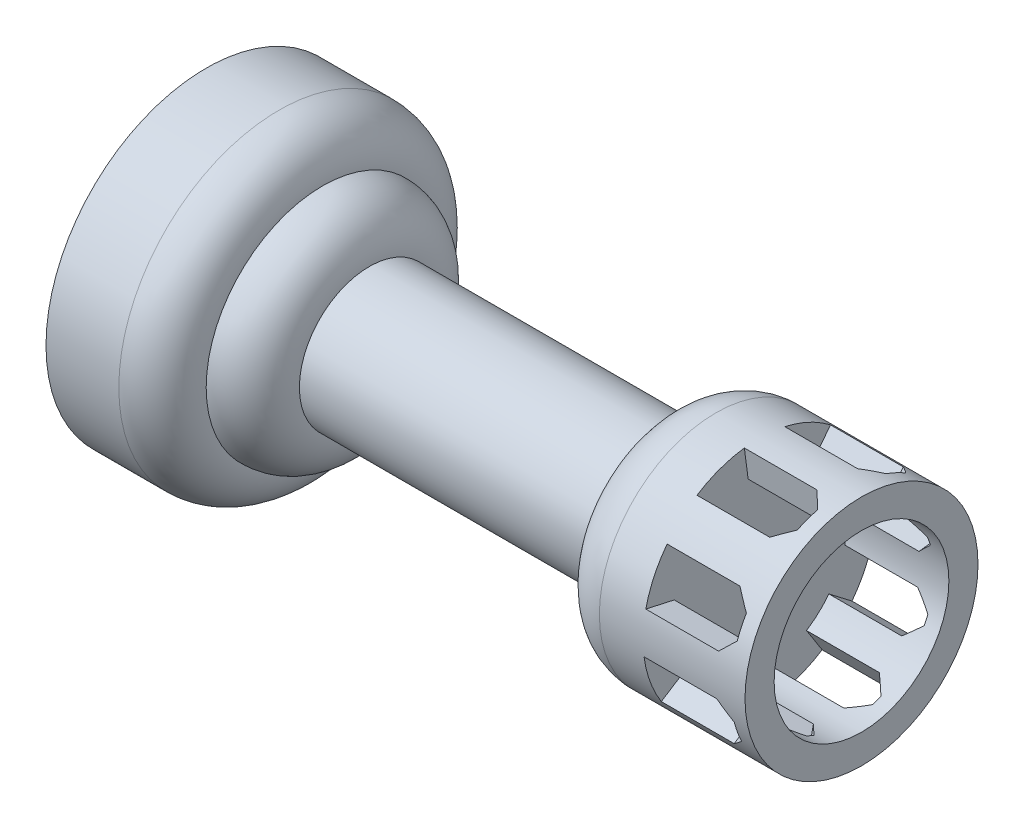
from build123d import *

# Parameters (mm, degrees)
SKETCH_2_R               = 10
CUT_EXTRUDE_1_DEPTH      = 2.5
CUT_EXTRUDE_START        = 6
CUT_EXTRUDE_2_DEPTH      = 6
PATTERN_CIRCULAR_1_COUNT = 8
CHAMFER_4_SIZE           = 1
CHAMFER_5_SIZE           = 1
CHAMFER_6_SIZE           = 1


with BuildPart() as part:
    # Эскиз1 → Повернуть11 (revolve)
    with BuildSketch(Plane(origin=(0, 0, 0), x_dir=(1, 0, 0), z_dir=(0, 1, 0))):
        with BuildLine():
            Line((0, 11), (0, 0))
            Line((0, 0), (5, 0))
            Line((5, 0), (5, 3))
            Line((5, 3), (8, 3))
            ThreePointArc((8, 3), (10.2627417, 3.9372583), (11.2, 6.2))
            Line((11.2, 6.2), (31.465178427, 6.2))
            ThreePointArc((31.465178427, 6.2), (32.615940251, 3.918829982), (35, 3))
            Line((35, 3), (45, 3))
            Line((45, 3), (45, 5))
            Line((45, 5), (38, 5))
            Line((38, 5), (38, 11))
            Line((38, 11), (0, 11))
        make_face()
    revolve(axis=Axis((0, 0, -11), (1, 0, 0)))

    # Эскиз2 → Вырез-Вытянуть1 (cut)
    with BuildSketch(Plane.ZY):
        with Locations((-11, 0)):
            Circle(SKETCH_2_R)
    extrude(amount=-CUT_EXTRUDE_1_DEPTH, mode=Mode.SUBTRACT)

    # Эскиз6 → Вырез-Вытянуть2 (cut)
    with BuildSketch(Plane(origin=(38, 0, 0), x_dir=(0, 0, -1), z_dir=(1, 0, 0)).offset(CUT_EXTRUDE_START)):
        with BuildLine():
            Line((4.653173278, 4.870091432), (6.239879958, 3.652568574))
            ThreePointArc((6.239879958, 3.652568574), (5.562153278, 2.53570957), (5.142223957, 1.298637684))
            Line((5.142223957, 1.298637684), (3.189631943, 1.731516912))
            ThreePointArc((3.189631943, 1.731516912), (3.749537704, 3.380946094), (4.653173278, 4.870091432))
        make_face()
    cut_extrude_2 = extrude(amount=-CUT_EXTRUDE_2_DEPTH, mode=Mode.SUBTRACT)

    # Круговой массив1: Вырез-Вытянуть2 ×8 about axis
    pattern_circular_1_axis = Axis((45, 0, -11), (-1, 0, 0))
    for i in range(1, PATTERN_CIRCULAR_1_COUNT):
        add(cut_extrude_2.rotate(pattern_circular_1_axis, i * 360 / PATTERN_CIRCULAR_1_COUNT), mode=Mode.SUBTRACT)

    # Эскиз1<12> → Повернуть12 (revolve)
    with BuildSketch(Plane(origin=(0, 0, 0), x_dir=(1, 0, 0), z_dir=(0, 1, 0))):
        with BuildLine():
            Line((5, 3), (5, 0))
            ThreePointArc((5, 0), (7.121320344, 0.878679656), (8, 3))
            Line((8, 3), (5, 3))
        make_face()
    revolve(axis=Axis((0, 0, -11), (1, 0, 0)))

    # Фаска4
    chamfer_4_edges = [part.edges().sort_by_distance(p)[0] for p in [
        (44, 3.761097258, -16.903740121),
        (44, 0.913683346, -17.94011403),
    ]]
    chamfer(chamfer_4_edges, length=CHAMFER_4_SIZE)

    # Фаска5
    chamfer_5_edges = [part.edges().sort_by_distance(p)[0] for p in [
        (44, 5.553473382, -15.261330003),
        (44, 6.83407205, -12.515077298),
    ]]
    chamfer(chamfer_5_edges, length=CHAMFER_5_SIZE)

    # Фаска6
    chamfer_6_edges = [part.edges().sort_by_distance(p)[0] for p in [
        (44, -1.515077298, -17.83407205),
        (44, -4.261330003, -16.553473382),
        (44, -6.94011403, -11.913683346),
        (44, -5.903740121, -14.761097258),
        (44, -6.83407205, -9.484922702),
        (44, -5.553473382, -6.738669997),
        (44, -3.761097258, -5.096259879),
        (44, -0.913683346, -4.05988597),
        (44, 1.515077298, -4.16592795),
        (44, 4.261330003, -5.446526618),
        (44, 5.903740121, -7.238902742),
        (44, 6.94011403, -10.086316654),
    ]]
    chamfer(chamfer_6_edges, length=CHAMFER_6_SIZE)


solid = part.part
